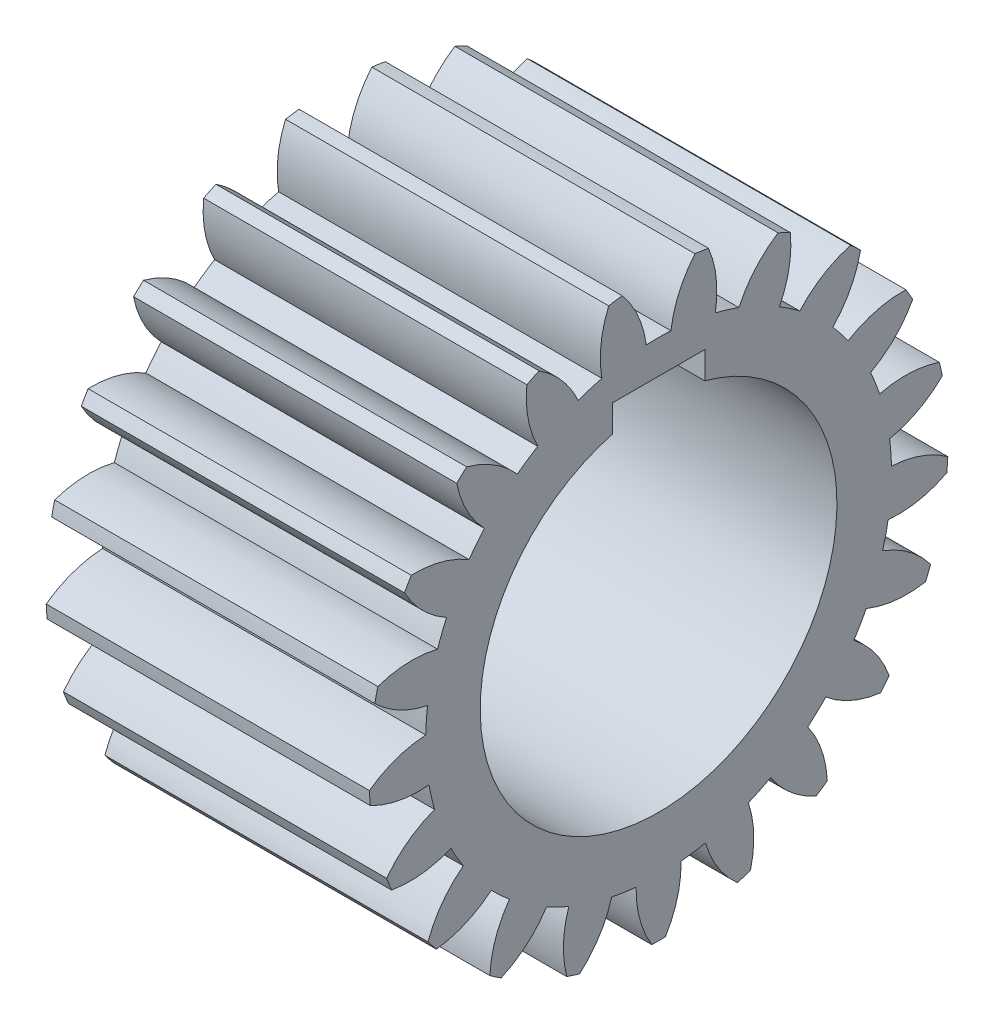
from build123d import *

# Parameters (mm, degrees)
BOSS_EXTRU_1_DEPTH = 77


with BuildPart() as part:
    # Esquisse1 → Boss.-Extru.1 (new body)
    with BuildSketch(Plane(origin=(40.821362871, 0, 0), x_dir=(0, 0, -1), z_dir=(1, 0, 0))):
        with BuildLine():
            ThreePointArc((-67.612453277, -3.518534748), (-61.812081339, -7.771811815), (-55.046417386, -10.213219545))
            ThreePointArc((-55.046417386, -10.213219545), (-55.34381354, -13.139028919), (-55.485808315, -16.076484017))
            ThreePointArc((-55.485808315, -16.076484017), (-62.539778332, -17.482253352), (-68.909282961, -20.82352425))
            ThreePointArc((-68.909282961, -20.82352425), (-68.807062006, -22.442850841), (-68.666793133, -24.059326134))
            ThreePointArc((-68.666793133, -24.059326134), (-61.870440021, -26.413952393), (-54.685737973, -26.752680769))
            ThreePointArc((-54.685737973, -26.752680769), (-54.107524198, -29.636163697), (-53.377380454, -32.484969601))
            ThreePointArc((-53.377380454, -32.484969601), (-59.70360459, -35.907478712), (-64.805273114, -40.977750767))
            ThreePointArc((-64.805273114, -40.977750767), (-64.230288656, -42.495005065), (-63.619787079, -43.99831992))
            ThreePointArc((-63.619787079, -43.99831992), (-56.431338594, -44.245076494), (-49.465990757, -42.451028013))
            ThreePointArc((-49.465990757, -42.451028013), (-48.063543885, -45.035974383), (-46.526138097, -47.543002188))
            ThreePointArc((-46.526138097, -47.543002188), (-51.562503575, -52.67814612), (-54.943030357, -59.026903409))
            ThreePointArc((-54.943030357, -59.026903409), (-53.94637229, -60.307270712), (-52.919883753, -61.563849007))
            ThreePointArc((-52.919883753, -61.563849007), (-45.978065087, -59.680810492), (-39.850973185, -55.913394235))
            ThreePointArc((-39.850973185, -55.913394235), (-37.748906774, -57.970120218), (-35.540844194, -59.9126095))
            ThreePointArc((-35.540844194, -59.9126095), (-38.839847839, -66.30410818), (-40.198858239, -73.367235757))
            ThreePointArc((-40.198858239, -73.367235757), (-38.869084006, -74.296949811), (-37.51781652, -75.195139051))
            ThreePointArc((-37.51781652, -75.195139051), (-31.439438727, -71.349621682), (-26.695021762, -65.943589116))
            ThreePointArc((-26.695021762, -65.943589116), (-24.080113637, -67.289345583), (-21.397590315, -68.494697646))
            ThreePointArc((-21.397590315, -68.494697646), (-22.666101177, -75.574638368), (-21.882841157, -82.724546352))
            ThreePointArc((-21.882841157, -82.724546352), (-20.338107034, -83.220997983), (-18.782126645, -83.680990111))
            ThreePointArc((-18.782126645, -83.680990111), (-14.107280265, -78.214684982), (-11.167100506, -71.650385825))
            ThreePointArc((-11.167100506, -71.650385825), (-8.271696731, -72.165596408), (-5.353066636, -72.526710431))
            ThreePointArc((-5.353066636, -72.526710431), (-4.478371957, -79.666009392), (-1.622437607, -86.267397081))
            ThreePointArc((-1.622437607, -86.267397081), (0, -86.286474383), (1.622437607, -86.267397081))
            ThreePointArc((1.622437607, -86.267397081), (4.478371957, -79.666009392), (5.353066636, -72.526710431))
            ThreePointArc((5.353066636, -72.526710431), (8.271696731, -72.165596408), (11.167100506, -71.650385825))
            ThreePointArc((11.167100506, -71.650385825), (14.107280265, -78.214684982), (18.782126645, -83.680990111))
            ThreePointArc((18.782126645, -83.680990111), (20.338107034, -83.220997983), (21.882841157, -82.724546352))
            ThreePointArc((21.882841157, -82.724546352), (22.666101177, -75.574638368), (21.397590315, -68.494697646))
            ThreePointArc((21.397590315, -68.494697646), (24.080113637, -67.289345583), (26.695021762, -65.943589116))
            ThreePointArc((26.695021762, -65.943589116), (31.439438727, -71.349621682), (37.51781652, -75.195139051))
            ThreePointArc((37.51781652, -75.195139051), (38.869084006, -74.296949811), (40.198858239, -73.367235757))
            ThreePointArc((40.198858239, -73.367235757), (38.839847839, -66.30410818), (35.540844194, -59.9126095))
            ThreePointArc((35.540844194, -59.9126095), (37.748906774, -57.970120218), (39.850973185, -55.913394235))
            ThreePointArc((39.850973185, -55.913394235), (45.978065087, -59.680810492), (52.919883753, -61.563849007))
            ThreePointArc((52.919883753, -61.563849007), (53.94637229, -60.307270712), (54.943030357, -59.026903409))
            ThreePointArc((54.943030357, -59.026903409), (51.562503575, -52.67814612), (46.526138097, -47.543002188))
            ThreePointArc((46.526138097, -47.543002188), (48.063543885, -45.035974383), (49.465990757, -42.451028013))
            ThreePointArc((49.465990757, -42.451028013), (56.431338594, -44.245076494), (63.619787079, -43.99831992))
            ThreePointArc((63.619787079, -43.99831992), (64.230288656, -42.495005065), (64.805273114, -40.977750767))
            ThreePointArc((64.805273114, -40.977750767), (59.70360459, -35.907478712), (53.377380454, -32.484969601))
            ThreePointArc((53.377380454, -32.484969601), (54.107524198, -29.636163697), (54.685737973, -26.752680769))
            ThreePointArc((54.685737973, -26.752680769), (61.870440021, -26.413952393), (68.666793133, -24.059326134))
            ThreePointArc((68.666793133, -24.059326134), (68.807062006, -22.442850841), (68.909282961, -20.82352425))
            ThreePointArc((68.909282961, -20.82352425), (62.539778332, -17.482253352), (55.485808315, -16.076484017))
            ThreePointArc((55.485808315, -16.076484017), (55.34381354, -13.139028919), (55.046417386, -10.213219545))
            ThreePointArc((55.046417386, -10.213219545), (61.812081339, -7.771811815), (67.612453277, -3.518534748))
            ThreePointArc((67.612453277, -3.518534748), (67.270025941, -1.93252994), (66.890400614, -0.355015331))
            ThreePointArc((66.890400614, -0.355015331), (59.819018318, 0.960367828), (52.664078611, 0.224488613))
            ThreePointArc((52.664078611, 0.224488613), (51.662562176, 2.989587128), (50.515981046, 5.697751946))
            ThreePointArc((50.515981046, 5.697751946), (56.261447972, 10.024909239), (60.550450236, 15.798914782))
            ThreePointArc((60.550450236, 15.798914782), (59.755752861, 17.213525617), (58.928012629, 18.609059149))
            ThreePointArc((58.928012629, 18.609059149), (51.783076015, 17.781677003), (45.16291441, 14.969535335))
            ThreePointArc((45.16291441, 14.969535335), (43.390865445, 17.31658613), (41.496978105, 19.566474063))
            ThreePointArc((41.496978105, 19.566474063), (45.711738053, 25.394894004), (48.10827397, 32.176582292))
            ThreePointArc((48.10827397, 32.176582292), (46.931918906, 33.294104773), (45.729612121, 34.383657949))
            ThreePointArc((45.729612121, 34.383657949), (39.145980162, 31.487027033), (33.64882707, 26.848494041))
            ThreePointArc((33.64882707, 26.848494041), (31.263699902, 28.568951352), (28.790786553, 30.160649984))
            ThreePointArc((28.790786553, 30.160649984), (31.100339606, 36.972451884), (31.391466441, 44.159240151))
            ThreePointArc((31.391466441, 44.159240151), (29.937977999, 44.880377502), (28.467934894, 45.567138742))
            ThreePointArc((28.467934894, 45.567138742), (23.030592182, 40.858637423), (19.14489378, 34.805867119))
            ThreePointArc((19.14489378, 34.805867119), (16.358617425, 35.746860765), (13.526407269, 36.538940686))
            ThreePointArc((13.526407269, 36.538940686), (13.725539503, 43.728866053), (11.885389361, 50.682176624))
            ThreePointArc((11.885389361, 50.682176624), (10.283916366, 50.942852626), (8.676756723, 51.165800179))
            ThreePointArc((8.676756723, 51.165800179), (4.868835019, 45.063799464), (2.93985266, 38.134607051))
            ThreePointArc((2.93985266, 38.134607051), (0, 38.212525617), (-2.93985266, 38.134607051))
            ThreePointArc((-2.93985266, 38.134607051), (-4.868835019, 45.063799464), (-8.676756723, 51.165800179))
            ThreePointArc((-8.676756723, 51.165800179), (-10.283916366, 50.942852626), (-11.885389361, 50.682176624))
            ThreePointArc((-11.885389361, 50.682176624), (-13.725539503, 43.728866053), (-13.526407269, 36.538940686))
            ThreePointArc((-13.526407269, 36.538940686), (-16.358617425, 35.746860765), (-19.14489378, 34.805867119))
            ThreePointArc((-19.14489378, 34.805867119), (-23.030592182, 40.858637423), (-28.467934894, 45.567138742))
            ThreePointArc((-28.467934894, 45.567138742), (-29.937977999, 44.880377502), (-31.391466441, 44.159240151))
            ThreePointArc((-31.391466441, 44.159240151), (-31.100339606, 36.972451884), (-28.790786553, 30.160649984))
            ThreePointArc((-28.790786553, 30.160649984), (-31.263699902, 28.568951352), (-33.64882707, 26.848494041))
            ThreePointArc((-33.64882707, 26.848494041), (-39.145980162, 31.487027033), (-45.729612121, 34.383657949))
            ThreePointArc((-45.729612121, 34.383657949), (-46.931918906, 33.294104773), (-48.10827397, 32.176582292))
            ThreePointArc((-48.10827397, 32.176582292), (-45.711738053, 25.394894004), (-41.496978105, 19.566474063))
            ThreePointArc((-41.496978105, 19.566474063), (-43.390865445, 17.31658613), (-45.16291441, 14.969535335))
            ThreePointArc((-45.16291441, 14.969535335), (-51.783076015, 17.781677003), (-58.928012629, 18.609059149))
            ThreePointArc((-58.928012629, 18.609059149), (-59.755752861, 17.213525617), (-60.550450236, 15.798914782))
            ThreePointArc((-60.550450236, 15.798914782), (-56.261447972, 10.024909239), (-50.515981046, 5.697751946))
            ThreePointArc((-50.515981046, 5.697751946), (-51.662562176, 2.989587128), (-52.664078611, 0.224488613))
            ThreePointArc((-52.664078611, 0.224488613), (-59.819018318, 0.960367828), (-66.890400614, -0.355015331))
            ThreePointArc((-66.890400614, -0.355015331), (-67.270025941, -1.93252994), (-67.612453277, -3.518534748))
        make_face()
        with BuildLine():
            Line((-11, 30.213525617), (11, 30.213525617))
            Line((11, 30.213525617), (11, 23.765322167))
            ThreePointArc((11, 23.765322167), (0, -59.786474383), (-11, 23.765322167))
            Line((-11, 23.765322167), (-11, 30.213525617))
        make_face(mode=Mode.SUBTRACT)
    extrude(amount=-BOSS_EXTRU_1_DEPTH)


solid = part.part
